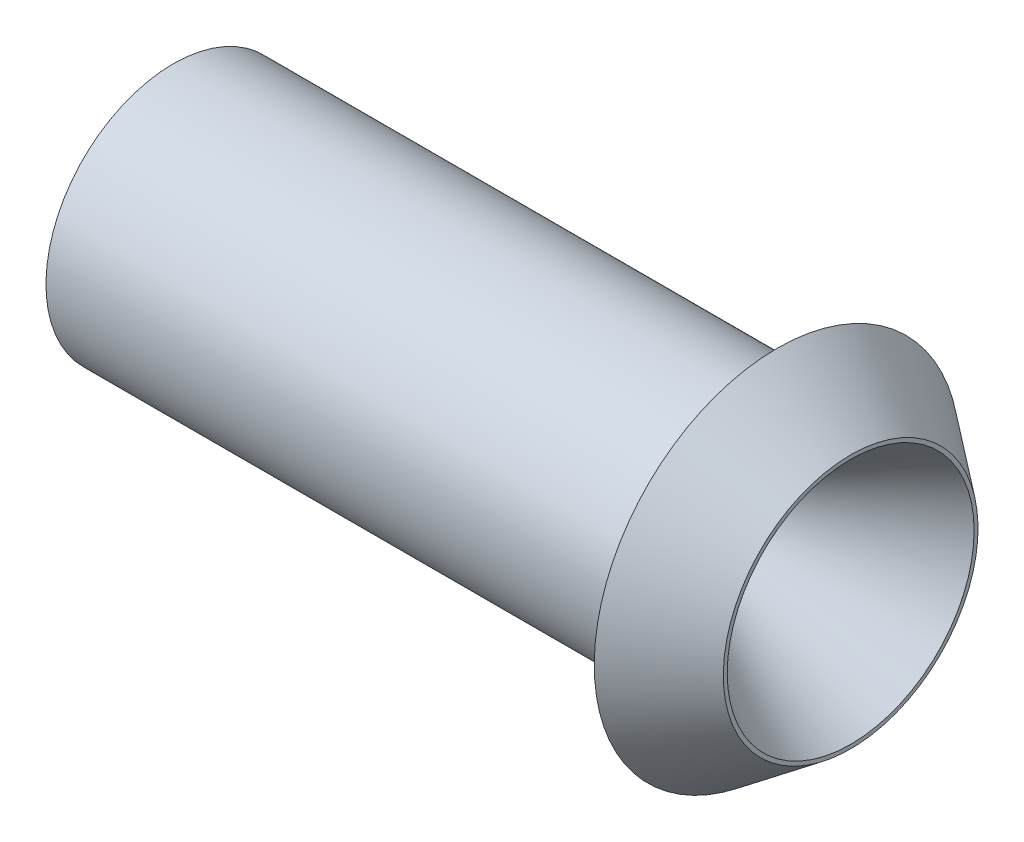
from build123d import *


with BuildPart() as part:
    # Sketch1 → Revolve1 (revolve)
    with BuildSketch(Plane.XY):
        Polygon((0, 8.255), (0, 8.001), (32.656261548, 2.24282), (33.926261548, 2.24282), (43.899721867, 8.001), (43.899721867, 8.255), (39.130190074, 11.8491), (39.130190074, 8.255), align=None)
    revolve(axis=Axis((43.899721867, 0, 0), (-1, 0, 0)))


solid = part.part
